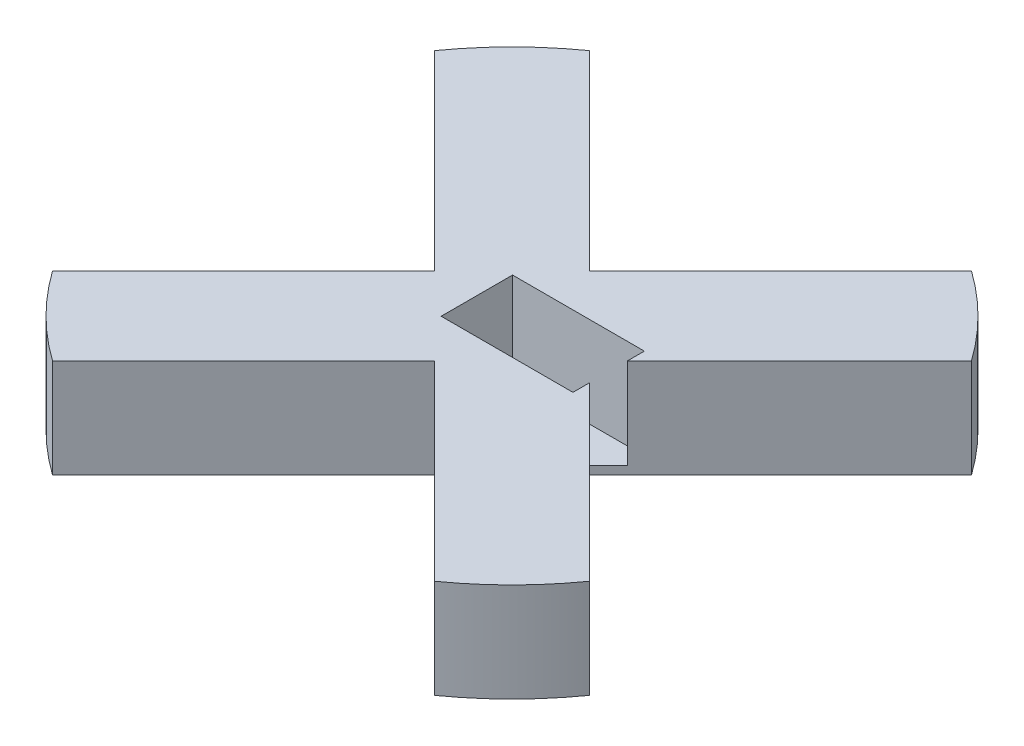
from build123d import *

# Parameters (mm, degrees)
BOSS_EXTRUDE2_DEPTH = 18
SKETCH7_W           = 24
SKETCH7_H           = 13
CUT_EXTRUDE8_DEPTH  = 16.5


with BuildPart() as part:
    # Sketch2 → Boss-Extrude2 (new body)
    with BuildSketch(Plane(origin=(0, 0, 0), x_dir=(1, 0, 0), z_dir=(0, 1, 0))):
        with BuildLine():
            Line((14.142135624, 0), (48.904069139, 34.761933515))
            ThreePointArc((48.904069139, 34.761933515), (42.426406871, 42.426406871), (34.761933515, 48.904069139))
            Line((34.761933515, 48.904069139), (0, 14.142135624))
            Line((0, 14.142135624), (-34.761933515, 48.904069139))
            ThreePointArc((-34.761933515, 48.904069139), (-42.426406871, 42.426406871), (-48.904069139, 34.761933515))
            Line((-48.904069139, 34.761933515), (-14.142135624, 0))
            Line((-14.142135624, 0), (-48.904069139, -34.761933515))
            ThreePointArc((-48.904069139, -34.761933515), (-42.426406871, -42.426406871), (-34.761933515, -48.904069139))
            Line((-34.761933515, -48.904069139), (0, -14.142135624))
            Line((0, -14.142135624), (34.761933515, -48.904069139))
            ThreePointArc((34.761933515, -48.904069139), (42.426406871, -42.426406871), (48.904069139, -34.761933515))
            Line((48.904069139, -34.761933515), (14.142135624, 0))
        make_face()
    extrude(amount=BOSS_EXTRUDE2_DEPTH)

    # Sketch7 → Cut-Extrude8 (cut)
    with BuildSketch(Plane(origin=(0, 18, 0), x_dir=(1, 0, 0), z_dir=(0, 1, 0))):
        with Locations((5.6, 0)):
            Rectangle(SKETCH7_W, SKETCH7_H)
    extrude(amount=-CUT_EXTRUDE8_DEPTH, mode=Mode.SUBTRACT)


solid = part.part
